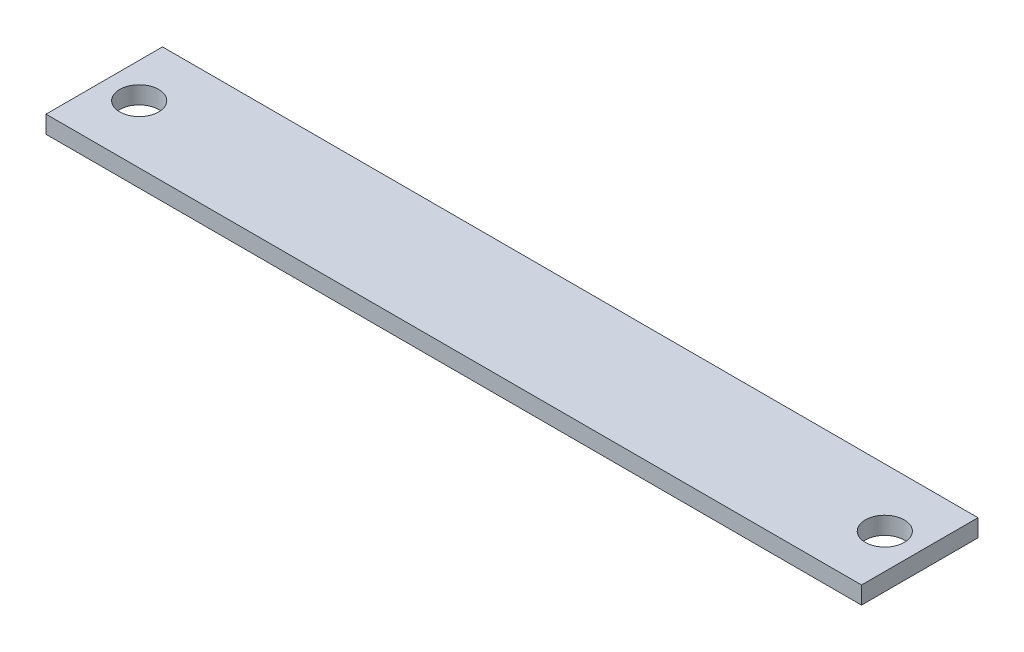
from build123d import *

# Parameters (mm, degrees)
SKETCH1_W           = 140
SKETCH1_H           = 20
SKETCH1_R           = 3.35
BOSS_EXTRUDE1_DEPTH = 3


with BuildPart() as part:
    # Sketch1 → Boss-Extrude1 (new body)
    with BuildSketch(Plane(origin=(0, 0, 0), x_dir=(1, 0, 0), z_dir=(0, 1, 0))):
        with Locations((-34.502164502, 11.038961039)):
            Rectangle(SKETCH1_W, SKETCH1_H)
        with Locations(Location((-98.502164502, 11.038961039, 0), (0, 0, 270))):
            Circle(SKETCH1_R, mode=Mode.SUBTRACT)
        with Locations(Location((29.497835498, 11.038961039, 0), (0, 0, 270))):
            Circle(SKETCH1_R, mode=Mode.SUBTRACT)
    extrude(amount=BOSS_EXTRUDE1_DEPTH)


solid = part.part
